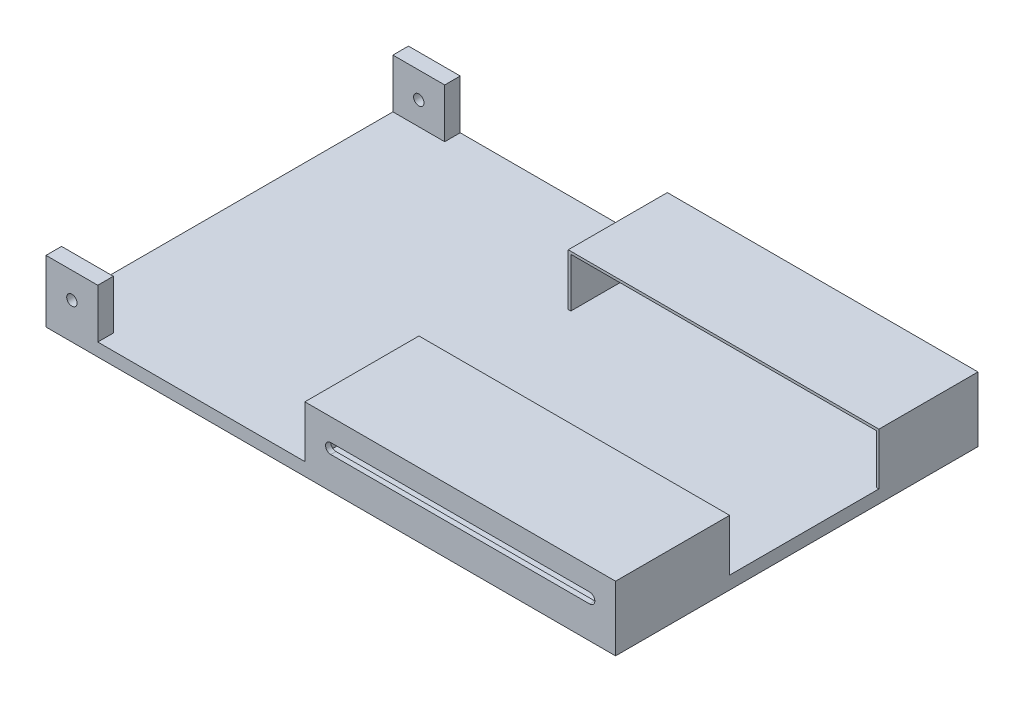
from build123d import *

# Parameters (mm, degrees)
SKETCH1_W             = 110
SKETCH1_H             = 70
BOSS_EXTRUDE1_DEPTH   = 2.5
SKETCH2_W             = 60
SKETCH2_H             = 12
BOSS_EXTRUDE2_DEPTH   = 1
SKETCH3_W             = 10
SKETCH3_H             = 12
BOSS_EXTRUDE3_DEPTH   = 3
SKETCH5_W             = 8
SKETCH5_H             = 9.5
BOSS_EXTRUDE4_DEPTH   = 0.5
SKETCH5_W_2           = 7
BOSS_EXTRUDE4_2_DEPTH = 0.5
SKETCH6_W             = 8
SKETCH6_H             = 9.5
SKETCH6_W_2           = 7
BOSS_EXTRUDE5_DEPTH   = 0.5
SKETCH7_W             = 60
SKETCH7_H             = 22.029201989
SKETCH7_H_2           = 19.138894139
BOSS_EXTRUDE6_DEPTH   = 0.5
CUT_EXTRUDE1_START    = -70
CUT_EXTRUDE1_DEPTH    = 70
CUT_EXTRUDE2_START    = -70
SKETCH11_R            = 1
CUT_EXTRUDE2_DEPTH    = 70
SKETCH12_W            = 13.029201989
SKETCH12_H            = 9.5
BOSS_EXTRUDE7_DEPTH   = 0.5
SKETCH13_W            = 13.029201989
SKETCH13_H            = 9.5
SKETCH13_W_2          = 11.138894139
BOSS_EXTRUDE8_DEPTH   = 0.5


with BuildPart() as part:
    # Sketch1 → Boss-Extrude1 (new body)
    with BuildSketch(Plane(origin=(0, 0, 0), x_dir=(1, 0, 0), z_dir=(0, 1, 0))):
        Rectangle(SKETCH1_W, SKETCH1_H)
    extrude(amount=-BOSS_EXTRUDE1_DEPTH)

    # Sketch2 → Boss-Extrude2 (add)
    with BuildSketch(Plane.XY.offset(35)):
        with Locations((25, 3.5)):
            Rectangle(SKETCH2_W, SKETCH2_H)
    boss_extrude2 = extrude(amount=-BOSS_EXTRUDE2_DEPTH)

    # Mirror1: Boss-Extrude2 across plane
    add(boss_extrude2.mirror(Plane.XY))

    # Sketch3 → Boss-Extrude3 (add)
    with BuildSketch(Plane.XY.offset(35)):
        with Locations((-50, 3.5)):
            Rectangle(SKETCH3_W, SKETCH3_H)
    boss_extrude3 = extrude(amount=-BOSS_EXTRUDE3_DEPTH)

    # Mirror2: Boss-Extrude3 across plane
    add(boss_extrude3.mirror(Plane.XY))

    # Sketch6 → Boss-Extrude5 (add)
    with BuildSketch(Plane.ZY.offset(5)):
        with Locations((30, 4.75)):
            Rectangle(SKETCH6_W, SKETCH6_H)
        with Locations((-30.5, 4.75)):
            Rectangle(SKETCH6_W_2, SKETCH6_H)
    extrude(amount=-BOSS_EXTRUDE5_DEPTH)



with BuildPart() as body_2:
    # Sketch5 → Boss-Extrude4 (new body)
    with BuildSketch(Plane(origin=(55, 0, 0), x_dir=(0, 0, -1), z_dir=(1, 0, 0))):
        with Locations((-30, 4.75)):
            Rectangle(SKETCH5_W, SKETCH5_H)
    extrude(amount=-BOSS_EXTRUDE4_DEPTH)


with BuildPart() as body_3:
    # Sketch5 → Boss-Extrude4 2 (new body)
    with BuildSketch(Plane(origin=(55, 0, 0), x_dir=(0, 0, -1), z_dir=(1, 0, 0))):
        with Locations((30.5, 4.75)):
            Rectangle(SKETCH5_W_2, SKETCH5_H)
    extrude(amount=-BOSS_EXTRUDE4_2_DEPTH)


with BuildPart() as part_1:
    add(part.part)

    add(body_2.part)  # Boss-Extrude6 merges body 2

    add(body_3.part)  # Boss-Extrude6 merges body 3
    # Sketch7 → Boss-Extrude6 (add)
    with BuildSketch(Plane(origin=(0, 9.5, 0), x_dir=(1, 0, 0), z_dir=(0, 1, 0))):
        with Locations((25, -23.985399005)):
            Rectangle(SKETCH7_W, SKETCH7_H)
        with Locations((25, 25.43055293)):
            Rectangle(SKETCH7_W, SKETCH7_H_2)
    extrude(amount=BOSS_EXTRUDE6_DEPTH)

    # Sketch10 → Cut-Extrude1 (cut)
    with BuildSketch(Plane(origin=(0, 0, -35), x_dir=(-1, 0, 0), z_dir=(0, 0, -1)).offset(CUT_EXTRUDE1_START)):
        with BuildLine():
            Line((0, 3.689665026), (-50, 3.689665026))
            ThreePointArc((-50, 3.689665026), (-51, 4.689665026), (-50, 5.689665026))
            Line((-50, 5.689665026), (0, 5.689665026))
            ThreePointArc((0, 5.689665026), (1, 4.689665026), (0, 3.689665026))
        make_face()
    extrude(amount=CUT_EXTRUDE1_DEPTH, mode=Mode.SUBTRACT)

    # Sketch11 → Cut-Extrude2 (cut)
    with BuildSketch(Plane(origin=(0, 0, -35), x_dir=(-1, 0, 0), z_dir=(0, 0, -1)).offset(CUT_EXTRUDE2_START)):
        with Locations((50, 4.5)):
            Circle(SKETCH11_R)
    extrude(amount=CUT_EXTRUDE2_DEPTH, mode=Mode.SUBTRACT)

    # Sketch12 → Boss-Extrude7 (add)
    with BuildSketch(Plane.ZY.offset(5)):
        Polygon((-15.861105861, 9.5), (-15.861105861, 0), (-26.92969018, 0), (-27, 9.5), align=None)
        with Locations((19.485399005, 4.75)):
            Rectangle(SKETCH12_W, SKETCH12_H)
    extrude(amount=-BOSS_EXTRUDE7_DEPTH)

    # Sketch13 → Boss-Extrude8 (add)
    with BuildSketch(Plane(origin=(55, 0, 0), x_dir=(0, 0, -1), z_dir=(1, 0, 0))):
        with Locations((-19.485399005, 4.75)):
            Rectangle(SKETCH13_W, SKETCH13_H)
        with Locations((21.43055293, 4.75)):
            Rectangle(SKETCH13_W_2, SKETCH13_H)
    extrude(amount=-BOSS_EXTRUDE8_DEPTH)


solid = part_1.part
